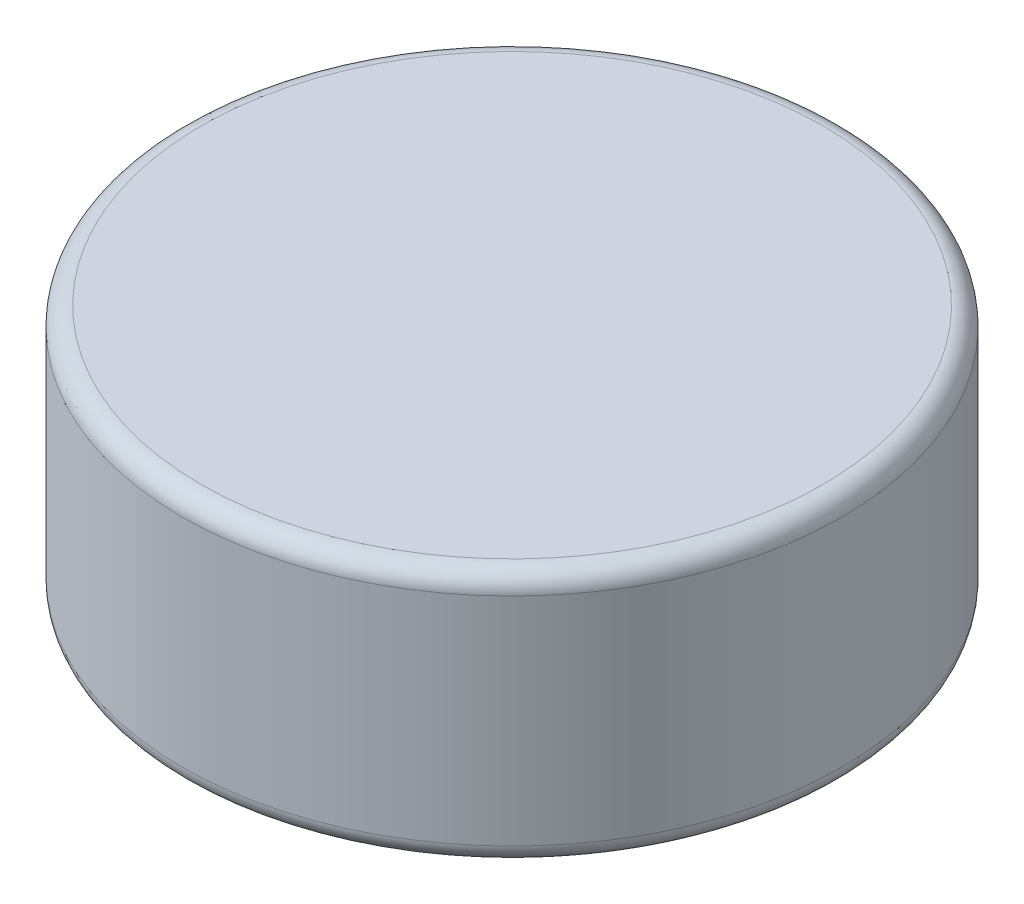
from build123d import *

# Parameters (mm, degrees)
ESBO_O1_R                = 35
RESSALTO_EXTRUS_O1_DEPTH = 27
FILETE1_R                = 2
ESBO_O2_R                = 5.75
RESSALTO_EXTRUS_O2_DEPTH = 2
ESBO_O3_R                = 3
CORTE_EXTRUS_O1_DEPTH    = 5


with BuildPart() as part:
    # Esboço1 → Ressalto-extrusão1 (new body)
    with BuildSketch(Plane(origin=(0, 0, 0), x_dir=(1, 0, 0), z_dir=(0, 1, 0))):
        with Locations(Location((0, 0, 0), (0, 0, 270))):
            Circle(ESBO_O1_R)
    extrude(amount=RESSALTO_EXTRUS_O1_DEPTH)

    # Filete1
    filete1_edges = [part.edges().sort_by_distance(p)[0] for p in [
        (0, 0, -35),
        (0, 27, -35),
    ]]
    fillet(filete1_edges, radius=FILETE1_R)

    # Esboço2 → Ressalto-extrusão2 (add)
    with BuildSketch(Plane(origin=(0, 0, 0), x_dir=(-1, 0, 0), z_dir=(0, -1, 0))):
        with Locations(Location((0, 0, 0), (0, 0, 270))):
            Circle(ESBO_O2_R)
    extrude(amount=RESSALTO_EXTRUS_O2_DEPTH)

    # Esboço3 → Corte-extrusão1 (cut)
    with BuildSketch(Plane.XZ.offset(2)):
        with Locations(Location((0, 0, 0), (0, 0, 270))):
            Circle(ESBO_O3_R)
    extrude(amount=-CORTE_EXTRUS_O1_DEPTH, mode=Mode.SUBTRACT)


solid = part.part
